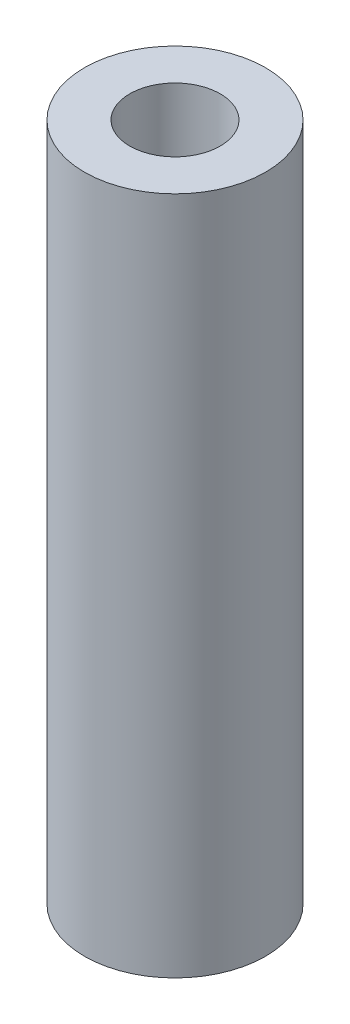
from build123d import *

# Parameters (mm, degrees)
SKETCH1_R           = 4
BOSS_EXTRUDE1_DEPTH = 30
SKETCH2_R           = 2
CUT_EXTRUDE1_DEPTH  = 31.528675045


with BuildPart() as part:
    # Sketch1 → Boss-Extrude1 (new body)
    with BuildSketch(Plane(origin=(0, 0, 0), x_dir=(1, 0, 0), z_dir=(0, 1, 0))):
        with Locations(Location((0, 0, 0), (0, 0, 270))):
            Circle(SKETCH1_R)
    extrude(amount=BOSS_EXTRUDE1_DEPTH)

    # Sketch2 → Cut-Extrude1 (cut, through all)
    with BuildSketch(Plane(origin=(0, 30, 0), x_dir=(1, 0, 0), z_dir=(0, 1, 0))):
        with Locations(Location((0, 0, 0), (0, 0, 270))):
            Circle(SKETCH2_R)
    extrude(amount=-CUT_EXTRUDE1_DEPTH, mode=Mode.SUBTRACT)


solid = part.part
